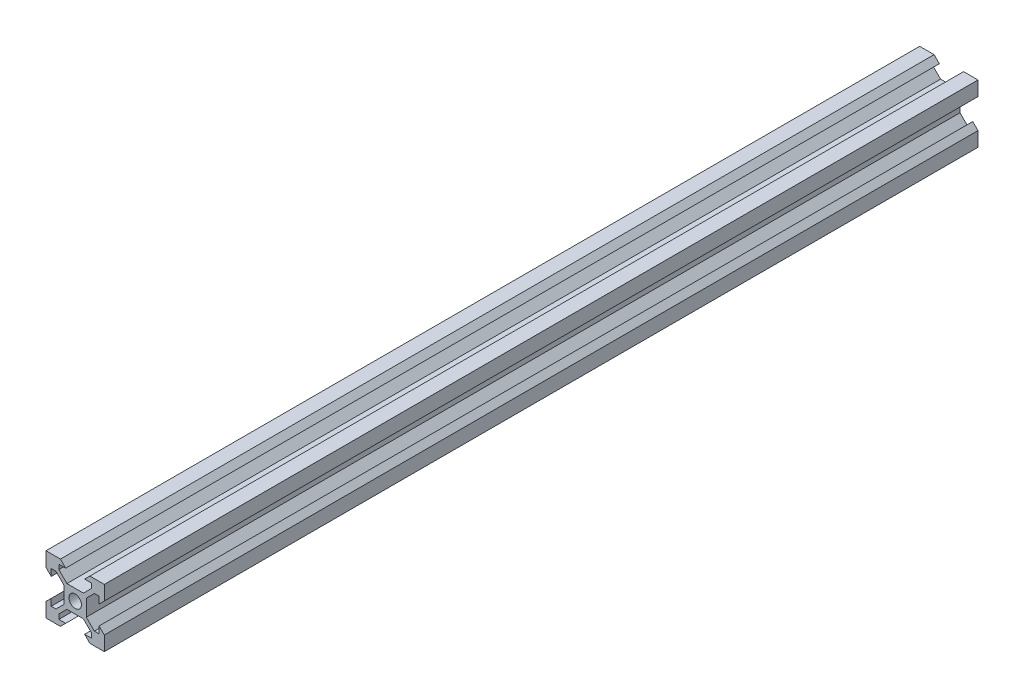
from build123d import *

# Parameters (mm, degrees)
CROQUIS1_R      = 2.15
BOSCHBASE_DEPTH = 299.71


with BuildPart() as part:
    # Croquis1 → BoschBase (new body)
    with BuildSketch(Plane.XY):
        Polygon((4.4, 0), (0, 0), (0, -0.56736664), (0, -4.4), (0, -4.95), (1.8, -6.75), (1.8, -4.4), (3.410050506, -4.4), (6.175, -7.164949494), (6.175, -12.835050506), (3.410050506, -15.6), (1.8, -15.6), (1.8, -13.25), (0, -15.05), (0, -15.6), (0, -20), (4.4, -20), (4.95, -20), (6.75, -18.2), (4.4, -18.2), (4.4, -16.589949494), (7.164949494, -13.825), (12.835050506, -13.825), (15.6, -16.589949494), (15.6, -18.2), (13.25, -18.2), (15.05, -20), (15.6, -20), (18.2, -20), (20, -20), (20, -15.6), (20, -15.05), (18.2, -13.25), (18.2, -15.6), (16.589949494, -15.6), (13.825, -12.835050506), (13.825, -7.164949494), (16.589949494, -4.4), (18.2, -4.4), (18.2, -6.75), (20, -4.95), (20, -4.4), (20, 0), (15.6, 0), (15.05, 0), (13.25, -1.8), (15.6, -1.8), (15.6, -3.410050506), (12.835050506, -6.175), (7.164949494, -6.175), (4.4, -3.410050506), (4.4, -1.8), (6.75, -1.8), (4.95, 0), align=None)
        with Locations((10, -10)):
            Circle(CROQUIS1_R, mode=Mode.SUBTRACT)
    extrude(amount=BOSCHBASE_DEPTH)


solid = part.part
